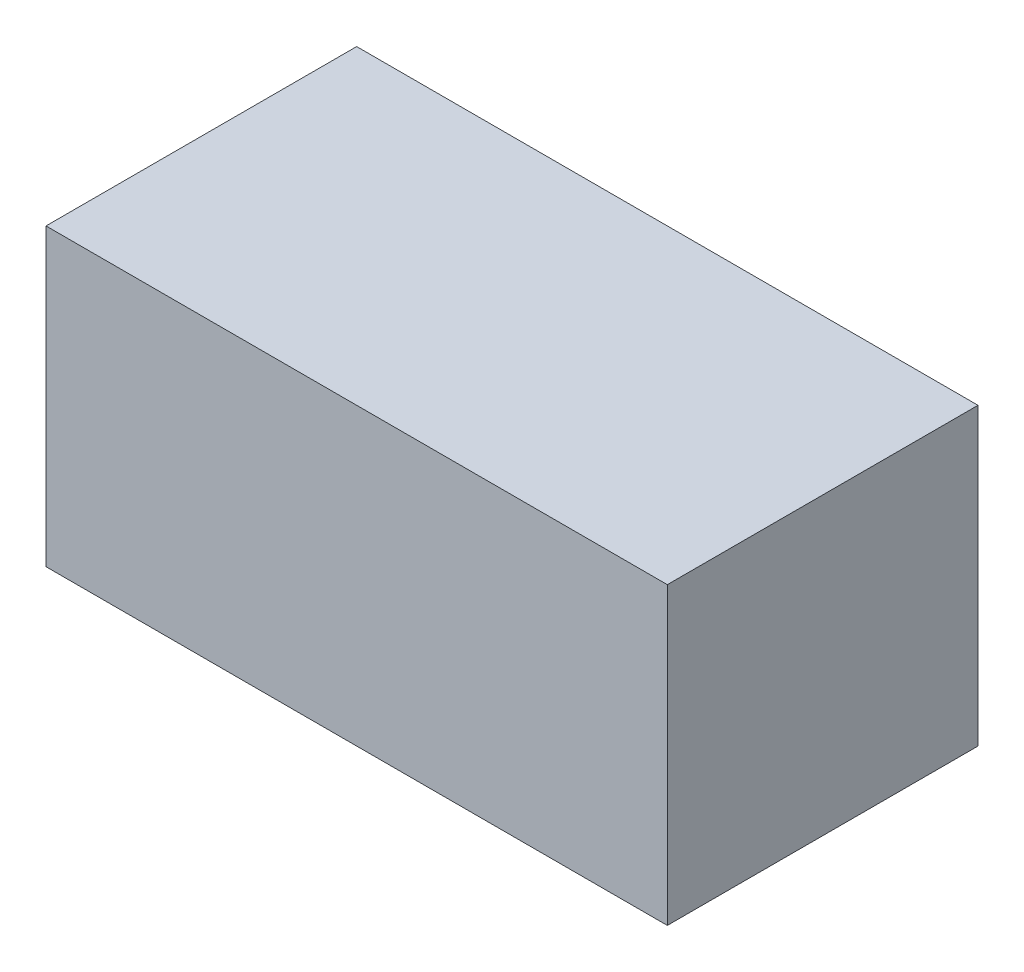
from build123d import *

# Parameters (mm, degrees)
SKETCH1_W           = 40
SKETCH1_H           = 20
BOSS_EXTRUDE1_DEPTH = 19


with BuildPart() as part:
    # Sketch1 → Boss-Extrude1 (new body)
    with BuildSketch(Plane(origin=(0, 0, 0), x_dir=(1, 0, 0), z_dir=(0, 1, 0))):
        with Locations((20, 10)):
            Rectangle(SKETCH1_W, SKETCH1_H)
    extrude(amount=BOSS_EXTRUDE1_DEPTH)


solid = part.part
